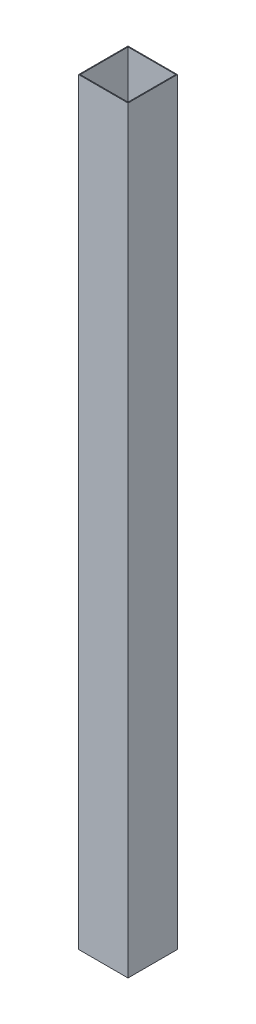
from build123d import *

# Parameters (mm, degrees)
SKETCH1_W           = 152.4
SKETCH1_H           = 152.4
SKETCH1_W_2         = 147.32
SKETCH1_H_2         = 147.32
BOSS_EXTRUDE1_DEPTH = 6019.8
SKETCH2_W           = 152.4
SKETCH2_H           = 3683
CUT_EXTRUDE1_DEPTH  = 6023.210909624


with BuildPart() as part:
    # Sketch1 → Boss-Extrude1 (new body)
    with BuildSketch(Plane(origin=(0, 0, 0), x_dir=(1, 0, 0), z_dir=(0, 1, 0))):
        Rectangle(SKETCH1_W, SKETCH1_H)
        Rectangle(SKETCH1_W_2, SKETCH1_H_2, mode=Mode.SUBTRACT)
    extrude(amount=BOSS_EXTRUDE1_DEPTH)

    # Sketch2 → Cut-Extrude1 (cut, through all)
    with BuildSketch(Plane.XY.offset(76.2)):
        with Locations((0, 4178.3)):
            Rectangle(SKETCH2_W, SKETCH2_H)
    extrude(amount=-CUT_EXTRUDE1_DEPTH, mode=Mode.SUBTRACT)


solid = part.part
